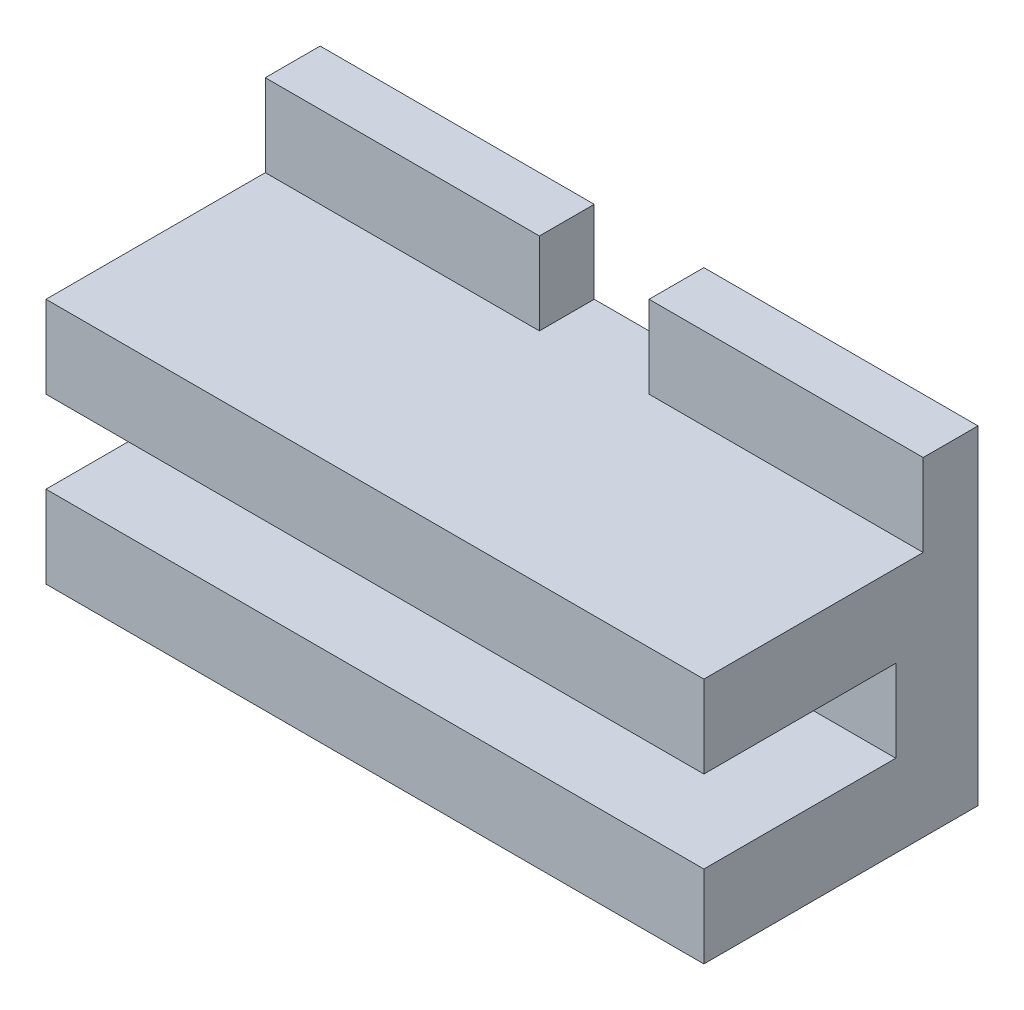
from build123d import *

# Parameters (mm, degrees)
SKETCH1_W           = 12
SKETCH1_H           = 5
BOSS_EXTRUDE1_DEPTH = 4.5
CUT_EXTRUDE1_START  = -1.5
SKETCH2_W           = 12
SKETCH2_H           = 3.5
CUT_EXTRUDE1_DEPTH  = 1.5
SKETCH4_W           = 5
SKETCH4_H           = 1
BOSS_EXTRUDE2_DEPTH = 1.5


with BuildPart() as part:
    # Sketch1 → Boss-Extrude1 (new body)
    with BuildSketch(Plane(origin=(0, 0, 0), x_dir=(1, 0, 0), z_dir=(0, 1, 0))):
        with Locations((6, -2.5)):
            Rectangle(SKETCH1_W, SKETCH1_H)
    extrude(amount=BOSS_EXTRUDE1_DEPTH)

    # Sketch2 → Cut-Extrude1 (cut)
    with BuildSketch(Plane(origin=(0, 4.5, 0), x_dir=(1, 0, 0), z_dir=(0, 1, 0)).offset(CUT_EXTRUDE1_START)):
        with Locations((6, -3.25)):
            Rectangle(SKETCH2_W, SKETCH2_H)
    extrude(amount=-CUT_EXTRUDE1_DEPTH, mode=Mode.SUBTRACT)

    # Sketch4 → Boss-Extrude2 (add)
    with BuildSketch(Plane(origin=(0, 4.5, 0), x_dir=(1, 0, 0), z_dir=(0, 1, 0))):
        with Locations((2.5, -0.5)):
            Rectangle(SKETCH4_W, SKETCH4_H)
        with Locations((9.5, -0.5)):
            Rectangle(SKETCH4_W, SKETCH4_H)
    extrude(amount=BOSS_EXTRUDE2_DEPTH)


solid = part.part
